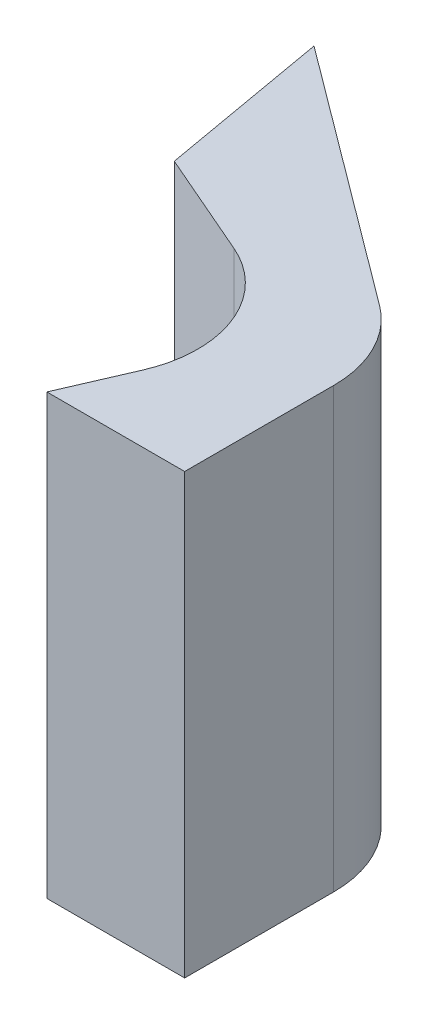
from build123d import *

# Parameters (mm, degrees)
EXTRUDE_1_DEPTH = 38.2


with BuildPart() as part:
    # 草图1 → 凸台-拉伸1 (new body)
    with BuildSketch(Plane(origin=(0, 0, 0), x_dir=(1, 0, 0), z_dir=(0, 1, 0))):
        with BuildLine():
            Line((0, 0), (12, 0))
            Line((12, 0), (12, 12.981790539))
            ThreePointArc((12, 12.981790539), (10.937752367, 17.466941888), (7.976683475, 20.999224956))
            Line((7.976683475, 20.999224956), (-14.457533577, 37.723055468))
            Line((-14.457533577, 37.723055468), (-11.852810912, 22.950939173))
            Line((-11.852810912, 22.950939173), (-2.676992607, 18.975469587))
            ThreePointArc((-2.676992607, 18.975469587), (2.646902656, 13.476853125), (2.523356111, 5.824181695))
            Line((2.523356111, 5.824181695), (0, 0))
        make_face()
    extrude(amount=EXTRUDE_1_DEPTH)


solid = part.part
